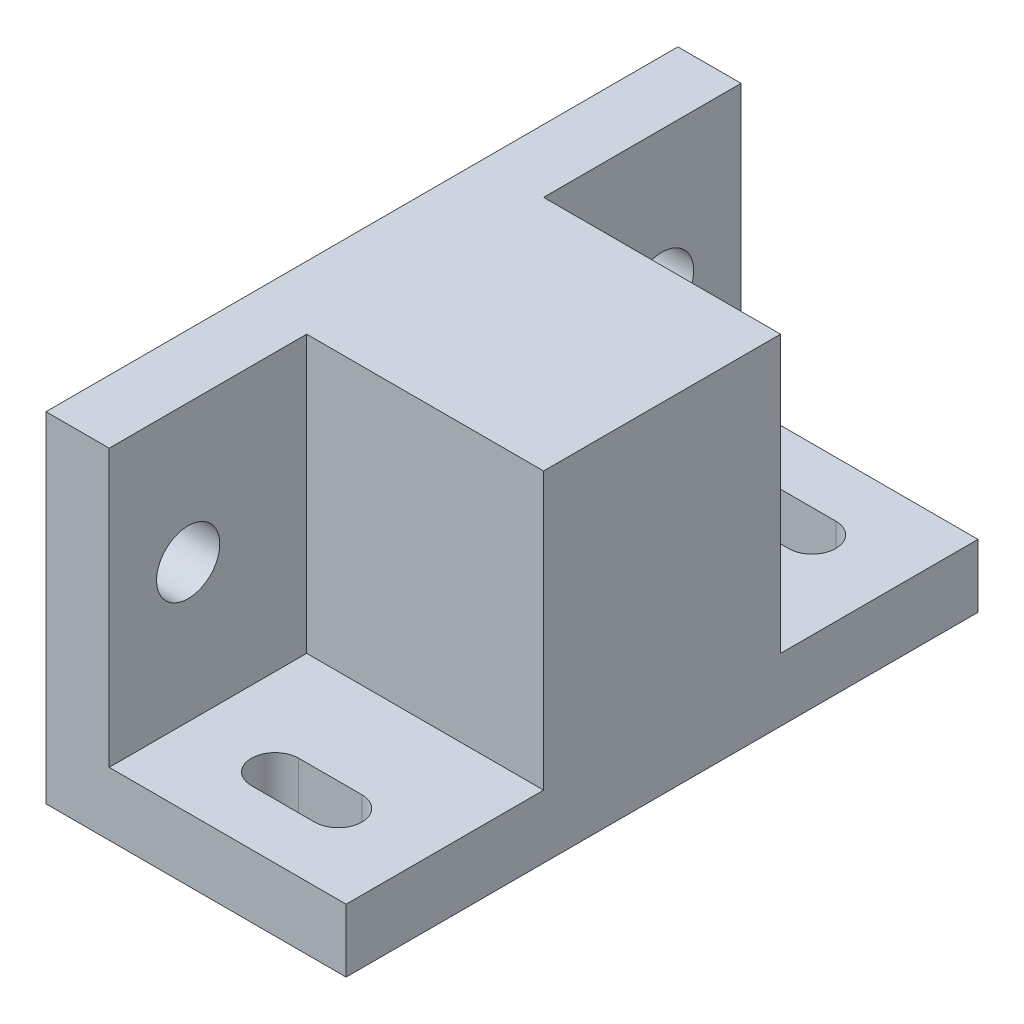
from build123d import *

# Parameters (mm, degrees)
EXTRUDE_1_DEPTH     = 40
CUT_EXTRUDE_1_DEPTH = 47.165463282
SKETCH_4_R          = 2
CUT_EXTRUDE_2_DEPTH = 47.165463282
SKETCH_5_W          = 15
SKETCH_5_H          = 15
EXTRUDE_2_DEPTH     = 17.5


with BuildPart() as part:
    # 草图1 → 凸台-拉伸1 (new body)
    with BuildSketch(Plane.XY):
        Polygon((0, 0), (15, 0), (15, -4), (-4, -4), (-4, 17.5), (0, 17.5), align=None)
    extrude(amount=EXTRUDE_1_DEPTH)

    # 草图2 → 切除-拉伸1 (cut, through all)
    with BuildSketch(Plane(origin=(0, 0, 0), x_dir=(1, 0, 0), z_dir=(0, 1, 0))):
        with BuildLine():
            Line((9.5, -36.5), (5.5, -36.5))
            ThreePointArc((5.5, -36.5), (4, -35), (5.5, -33.5))
            Line((5.5, -33.5), (9.5, -33.5))
            ThreePointArc((9.5, -33.5), (11, -35), (9.5, -36.5))
        make_face()
        with BuildLine():
            Line((9.5, -3.5), (5.5, -3.5))
            ThreePointArc((5.5, -3.5), (4, -5), (5.5, -6.5))
            Line((5.5, -6.5), (9.5, -6.5))
            ThreePointArc((9.5, -6.5), (11, -5), (9.5, -3.5))
        make_face()
    extrude(amount=-CUT_EXTRUDE_1_DEPTH, mode=Mode.SUBTRACT)

    # 草图4 → 切除-拉伸2 (cut, through all)
    with BuildSketch(Plane(origin=(0, 0, 0), x_dir=(0, 0, -1), z_dir=(1, 0, 0))):
        with Locations((-35, 8.75)):
            Circle(SKETCH_4_R)
        with Locations(Location((-5, 8.75, 0), (0, 0, 180))):
            Circle(SKETCH_4_R)
    extrude(amount=-CUT_EXTRUDE_2_DEPTH, mode=Mode.SUBTRACT)

    # 草图5 → 凸台-拉伸2 (add)
    with BuildSketch(Plane(origin=(0, 0, 0), x_dir=(1, 0, 0), z_dir=(0, 1, 0))):
        with Locations((7.5, -20)):
            Rectangle(SKETCH_5_W, SKETCH_5_H)
    extrude(amount=EXTRUDE_2_DEPTH)


solid = part.part
